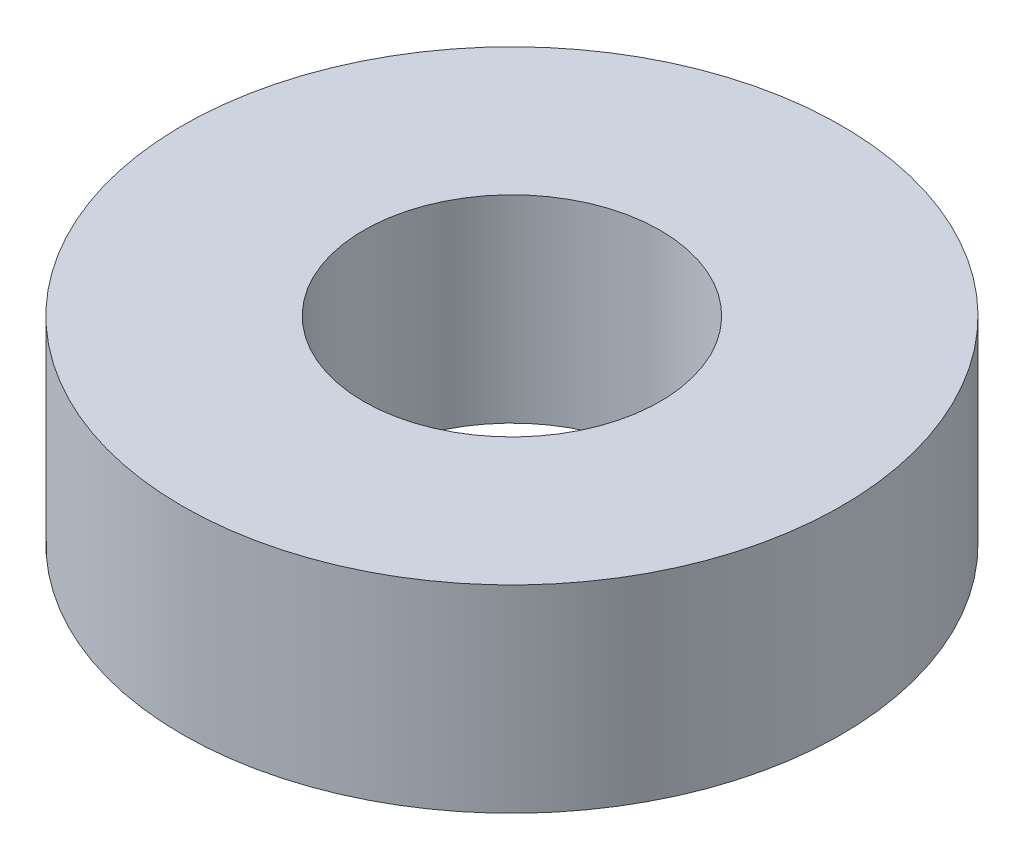
from build123d import *

# Parameters (mm, degrees)
ESQUISSE1_R        = 10
ESQUISSE1_R_2      = 4.5
BOSS_EXTRU_1_DEPTH = 6


with BuildPart() as part:
    # Esquisse1 → Boss.-Extru.1 (new body)
    with BuildSketch(Plane(origin=(0, 0, 0), x_dir=(1, 0, 0), z_dir=(0, 1, 0))):
        with Locations(Location((0, 0, 0), (0, 0, 270))):
            Circle(ESQUISSE1_R)
        with Locations(Location((0, 0, 0), (0, 0, 270))):
            Circle(ESQUISSE1_R_2, mode=Mode.SUBTRACT)
    extrude(amount=BOSS_EXTRU_1_DEPTH)


solid = part.part
